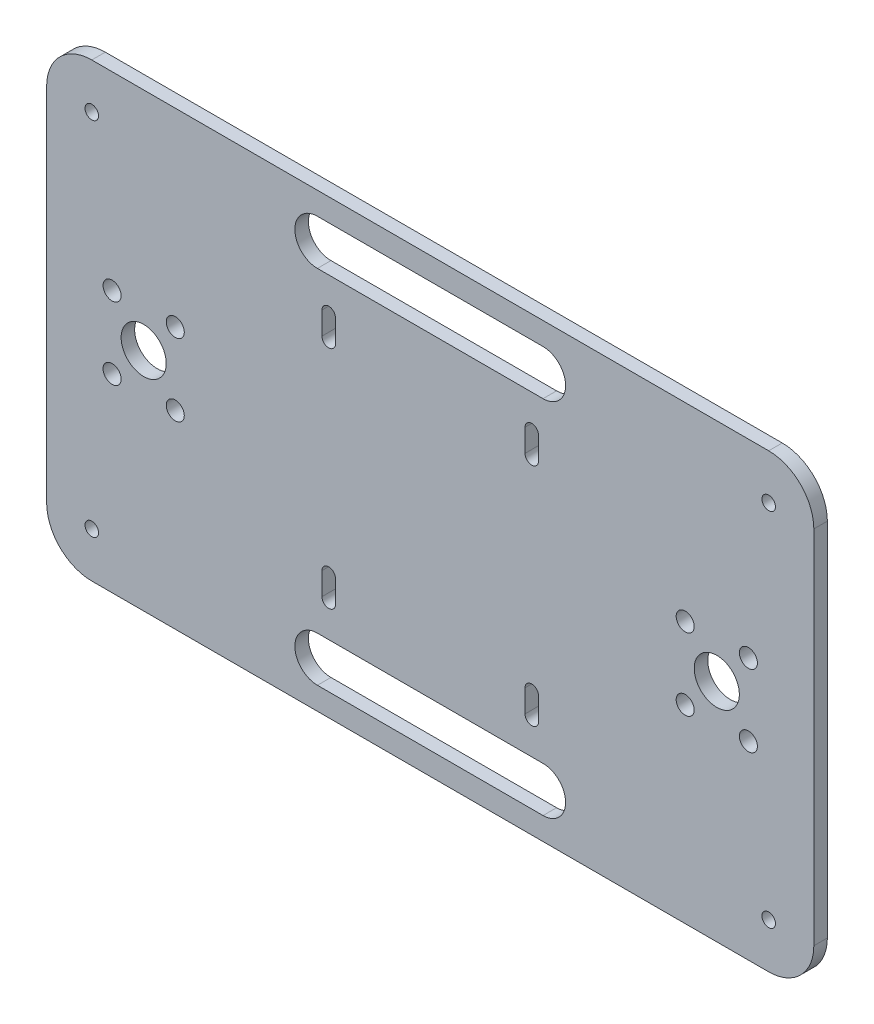
from build123d import *

# Parameters (mm, degrees)
SKETCH1_R           = 2
SKETCH1_R_2         = 1.5
SKETCH1_R_3         = 5
BOSS_EXTRUDE1_DEPTH = 3


with BuildPart() as part:
    # Sketch1 → Boss-Extrude1 (new body)
    with BuildSketch(Plane.XY):
        with BuildLine():
            Line((-75, 50), (75, 50))
            ThreePointArc((75, 50), (82.071067812, 47.071067812), (85, 40))
            Line((85, 40), (85, -40))
            ThreePointArc((85, -40), (82.071067812, -47.071067812), (75, -50))
            Line((75, -50), (-75, -50))
            ThreePointArc((-75, -50), (-82.071067812, -47.071067812), (-85, -40))
            Line((-85, -40), (-85, 40))
            ThreePointArc((-85, 40), (-82.071067812, 47.071067812), (-75, 50))
        make_face()
        with Locations((-70.5, 8)):
            Circle(SKETCH1_R, mode=Mode.SUBTRACT)
        with Locations((-70.5, -8)):
            Circle(SKETCH1_R, mode=Mode.SUBTRACT)
        with Locations((-56.5, -8)):
            Circle(SKETCH1_R, mode=Mode.SUBTRACT)
        with Locations((-56.5, 8)):
            Circle(SKETCH1_R, mode=Mode.SUBTRACT)
        with Locations((70.5, -8)):
            Circle(SKETCH1_R, mode=Mode.SUBTRACT)
        with Locations((56.5, -8)):
            Circle(SKETCH1_R, mode=Mode.SUBTRACT)
        with Locations((56.5, 8)):
            Circle(SKETCH1_R, mode=Mode.SUBTRACT)
        with Locations((70.5, 8)):
            Circle(SKETCH1_R, mode=Mode.SUBTRACT)
        with Locations((-75, -40)):
            Circle(SKETCH1_R_2, mode=Mode.SUBTRACT)
        with Locations((-75, 40)):
            Circle(SKETCH1_R_2, mode=Mode.SUBTRACT)
        with Locations((75, 40)):
            Circle(SKETCH1_R_2, mode=Mode.SUBTRACT)
        with Locations((75, -40)):
            Circle(SKETCH1_R_2, mode=Mode.SUBTRACT)
        with Locations((-63.5, 0)):
            Circle(SKETCH1_R_3, mode=Mode.SUBTRACT)
        with Locations((63.5, 0)):
            Circle(SKETCH1_R_3, mode=Mode.SUBTRACT)
        with BuildLine():
            Line((-25, 45), (25, 45))
            ThreePointArc((25, 45), (30, 40), (25, 35))
            Line((25, 35), (-25, 35))
            ThreePointArc((-25, 35), (-30, 40), (-25, 45))
        make_face(mode=Mode.SUBTRACT)
        with BuildLine():
            Line((-25, -45), (25, -45))
            ThreePointArc((25, -45), (30, -40), (25, -35))
            Line((25, -35), (-25, -35))
            ThreePointArc((-25, -35), (-30, -40), (-25, -45))
        make_face(mode=Mode.SUBTRACT)
        with BuildLine():
            Line((-24, -27.5), (-24, -22.5))
            ThreePointArc((-24, -22.5), (-22.5, -21), (-21, -22.5))
            Line((-21, -22.5), (-21, -27.5))
            ThreePointArc((-21, -27.5), (-22.5, -29), (-24, -27.5))
        make_face(mode=Mode.SUBTRACT)
        with BuildLine():
            Line((-24, 27.5), (-24, 22.5))
            ThreePointArc((-24, 22.5), (-22.5, 21), (-21, 22.5))
            Line((-21, 22.5), (-21, 27.5))
            ThreePointArc((-21, 27.5), (-22.5, 29), (-24, 27.5))
        make_face(mode=Mode.SUBTRACT)
        with BuildLine():
            Line((24, 27.5), (24, 22.5))
            ThreePointArc((24, 22.5), (22.5, 21), (21, 22.5))
            Line((21, 22.5), (21, 27.5))
            ThreePointArc((21, 27.5), (22.5, 29), (24, 27.5))
        make_face(mode=Mode.SUBTRACT)
        with BuildLine():
            Line((24, -27.5), (24, -22.5))
            ThreePointArc((24, -22.5), (22.5, -21), (21, -22.5))
            Line((21, -22.5), (21, -27.5))
            ThreePointArc((21, -27.5), (22.5, -29), (24, -27.5))
        make_face(mode=Mode.SUBTRACT)
    extrude(amount=BOSS_EXTRUDE1_DEPTH)


solid = part.part
